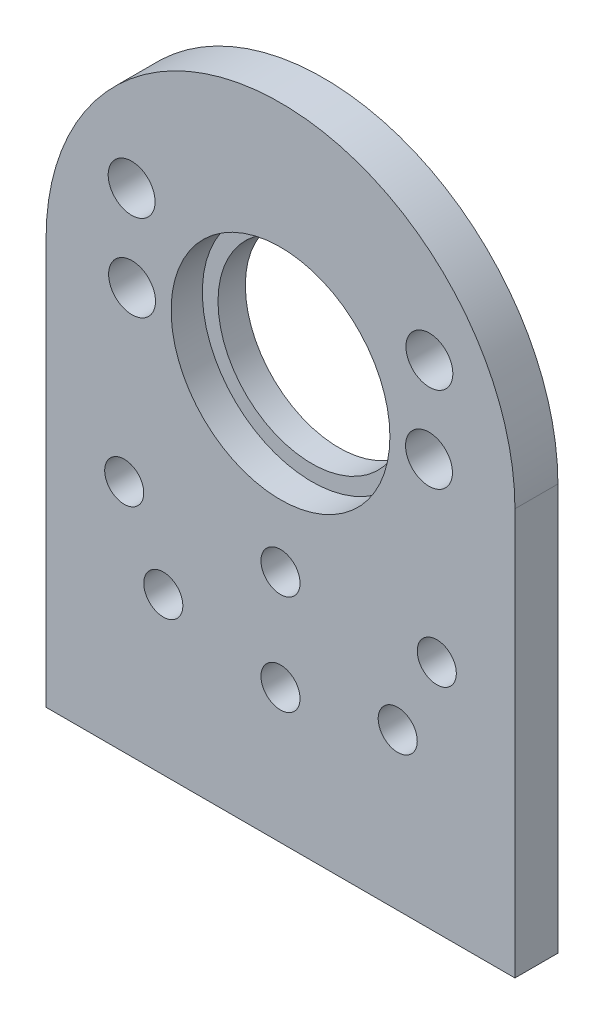
from build123d import *

# Parameters (mm, degrees)
SKETCH1_R           = 6
SKETCH1_R_2         = 1.5
SKETCH1_R_3         = 1.25
BOSS_EXTRUDE1_DEPTH = 3.75
SKETCH2_R           = 7
CUT_EXTRUDE1_DEPTH  = 2
CUT_EXTRUDE2_DEPTH  = 1
SKETCH4_R           = 1.5
CUT_EXTRUDE3_DEPTH  = 10


with BuildPart() as part:
    # Sketch1 → Boss-Extrude1 (new body)
    with BuildSketch(Plane.XY):
        with BuildLine():
            Line((-14.999999511, 12.999998728), (-14.999999511, -12.999999576))
            Line((-14.999999511, -12.999999576), (15.000000489, -12.999999576))
            Line((15.000000489, -12.999999576), (15.000000489, 13.000000424))
            ThreePointArc((15.000000489, 13.000000424), (-3.59e-07, 28), (-14.999999511, 12.999998728))
        make_face()
        with Locations((4.89e-07, 13)):
            Circle(SKETCH1_R, mode=Mode.SUBTRACT)
        with Locations((-9.499999511, 13)):
            Circle(SKETCH1_R_2, mode=Mode.SUBTRACT)
        with Locations((9.500000489, 13)):
            Circle(SKETCH1_R_2, mode=Mode.SUBTRACT)
        with Locations((-7.5, -3)):
            Circle(SKETCH1_R_3, mode=Mode.SUBTRACT)
        with Locations((7.5, -3)):
            Circle(SKETCH1_R_3, mode=Mode.SUBTRACT)
        with Locations((10.000000489, 2)):
            Circle(SKETCH1_R_3, mode=Mode.SUBTRACT)
        with Locations((-9.999999511, 2)):
            Circle(SKETCH1_R_3, mode=Mode.SUBTRACT)
        with Locations((0, 2)):
            Circle(SKETCH1_R_3, mode=Mode.SUBTRACT)
        with Locations((0, -4.4)):
            Circle(SKETCH1_R_3, mode=Mode.SUBTRACT)
    extrude(amount=BOSS_EXTRUDE1_DEPTH)

    # Sketch2 → Cut-Extrude1 (cut)
    with BuildSketch(Plane.XY.offset(3.75)):
        with Locations((4.89e-07, 13)):
            Circle(SKETCH2_R)
    extrude(amount=-CUT_EXTRUDE1_DEPTH, mode=Mode.SUBTRACT)

    # Sketch3 → Cut-Extrude2 (cut)
    with BuildSketch(Plane.XY):
        with BuildLine():
            Line((15.000000489, -12.999999576), (15.000000489, 13.000000424))
            ThreePointArc((15.000000489, 13.000000424), (-3.59e-07, 28), (-14.999999511, 12.999998728))
            Line((-14.999999511, 12.999998728), (-14.999999511, -12.999999576))
            Line((-14.999999511, -12.999999576), (15.000000489, -12.999999576))
        make_face()
        with BuildLine():
            Line((-13.499999511, 12.999998855), (-13.499999511, -11.499999576))
            Line((-13.499999511, -11.499999576), (13.500000489, -11.499999576))
            Line((13.500000489, -11.499999576), (13.500000489, 13.000000382))
            ThreePointArc((13.500000489, 13.000000382), (-2.74e-07, 26.5), (-13.499999511, 12.999998855))
        make_face(mode=Mode.SUBTRACT)
    extrude(amount=CUT_EXTRUDE2_DEPTH, mode=Mode.SUBTRACT)

    # Sketch4 → Cut-Extrude3 (cut)
    with BuildSketch(Plane.XY.offset(3.75)):
        with Locations((-9.526278952, 18.5)):
            Circle(SKETCH4_R)
        with Locations((9.526280345, 18.499999283)):
            Circle(SKETCH4_R)
    extrude(amount=-CUT_EXTRUDE3_DEPTH, mode=Mode.SUBTRACT)


solid = part.part
